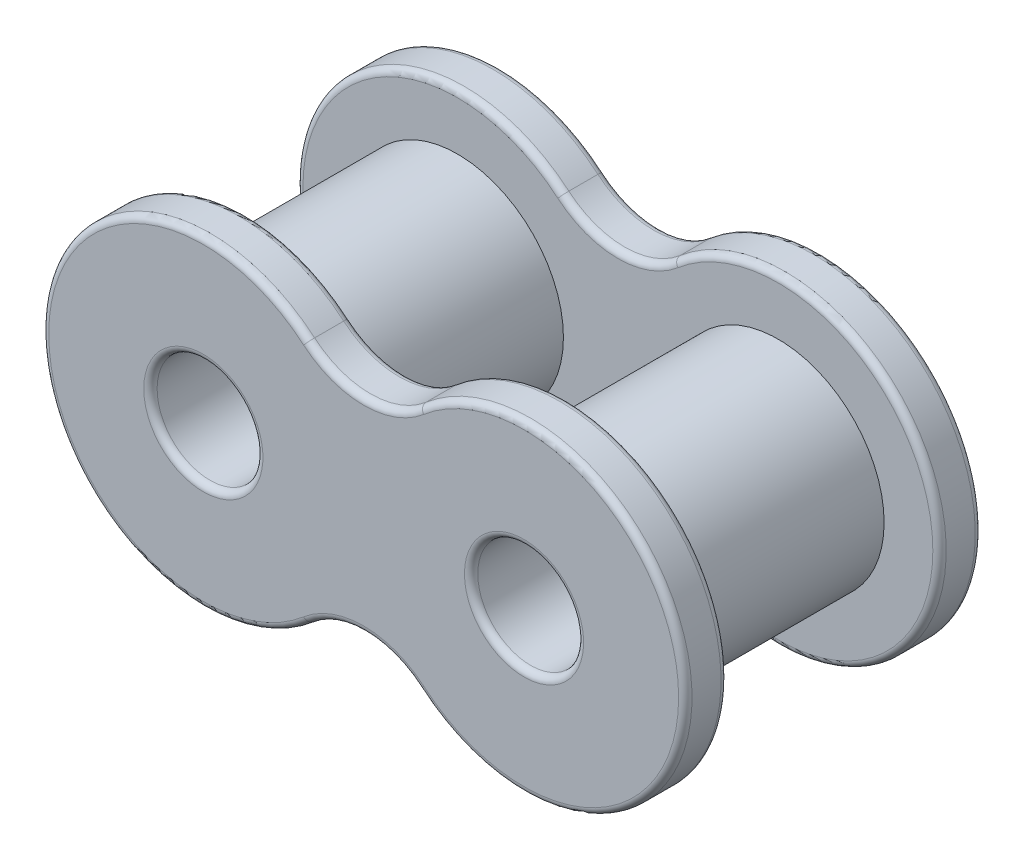
from build123d import *

# Parameters (mm, degrees)
SKETCH1_R            = 1.98
BOSS_EXTRUDE1_DEPTH  = 1.587
FILLET1_R            = 0.25
SKETCH2_R            = 3.962
SKETCH2_R_2          = 1.98
BOSS_EXTRUDE2_DEPTH  = 7.9248
FILLET1_OF_MIRROR3_R = 0.25
FILLET2_R            = 0.25


with BuildPart() as part:
    # Sketch1 → Boss-Extrude1 (new body)
    with BuildSketch(Plane.XY):
        with BuildLine():
            ThreePointArc((-2.085023304, 4.592840349), (-12.035, 0), (-2.085023304, -4.592840349))
            ThreePointArc((-2.085023304, -4.592840349), (0, -3.824780481), (2.085023304, -4.592840349))
            ThreePointArc((2.085023304, -4.592840349), (12.035, 0), (2.085023304, 4.592840349))
            ThreePointArc((2.085023304, 4.592840349), (0, 3.824780481), (-2.085023304, 4.592840349))
        make_face()
        with Locations((-6, 0)):
            Circle(SKETCH1_R, mode=Mode.SUBTRACT)
        with Locations(Location((6, 0, 0), (0, 0, 180))):
            Circle(SKETCH1_R, mode=Mode.SUBTRACT)
    boss_extrude1 = extrude(amount=BOSS_EXTRUDE1_DEPTH)

    # Fillet1
    fillet1_edges = [part.edges().sort_by_distance(p)[0] for p in [
        (0, -3.824780481, 1.587),
        (12.035, 0, 1.587),
        (0, 3.824780481, 1.587),
        (12.035, 0, 0),
        (0, -3.824780481, 0),
        (-12.035, 0, 0),
        (0, 3.824780481, 0),
        (-12.035, 0, 1.587),
    ]]
    fillet(fillet1_edges, radius=FILLET1_R)

    # Sketch2 → Boss-Extrude2 (add)
    with BuildSketch(Plane.XY.offset(1.587)):
        with Locations((-6, 0)):
            Circle(SKETCH2_R)
        with Locations((-6, 0)):
            Circle(SKETCH2_R_2, mode=Mode.SUBTRACT)
    boss_extrude2 = extrude(amount=BOSS_EXTRUDE2_DEPTH)

    # Mirror1: Boss-Extrude2 across plane
    add(boss_extrude2.mirror(Plane(origin=(0, 0, 0), x_dir=(0, 0, 1), z_dir=(1, 0, 0))))

    # Mirror3: Boss-Extrude1 across plane
    add(boss_extrude1.mirror(Plane.XY.offset(5.5494)))

    # Fillet1 of Mirror3
    fillet1_of_mirror3_edges = [part.edges().sort_by_distance(p)[0] for p in [
        (0, -3.824780481, 9.5118),
        (12.035, 0, 9.5118),
        (0, 3.824780481, 9.5118),
        (12.035, 0, 11.0988),
        (0, -3.824780481, 11.0988),
        (-12.035, 0, 11.0988),
        (0, 3.824780481, 11.0988),
        (-12.035, 0, 9.5118),
    ]]
    fillet(fillet1_of_mirror3_edges, radius=FILLET1_OF_MIRROR3_R)

    # Fillet2
    fillet2_edges = [part.edges().sort_by_distance(p)[0] for p in [
        (-7.98, 0, 0),
        (7.98, 0, 0),
        (-7.98, 0, 11.0988),
        (7.98, 0, 11.0988),
    ]]
    fillet(fillet2_edges, radius=FILLET2_R)


solid = part.part
